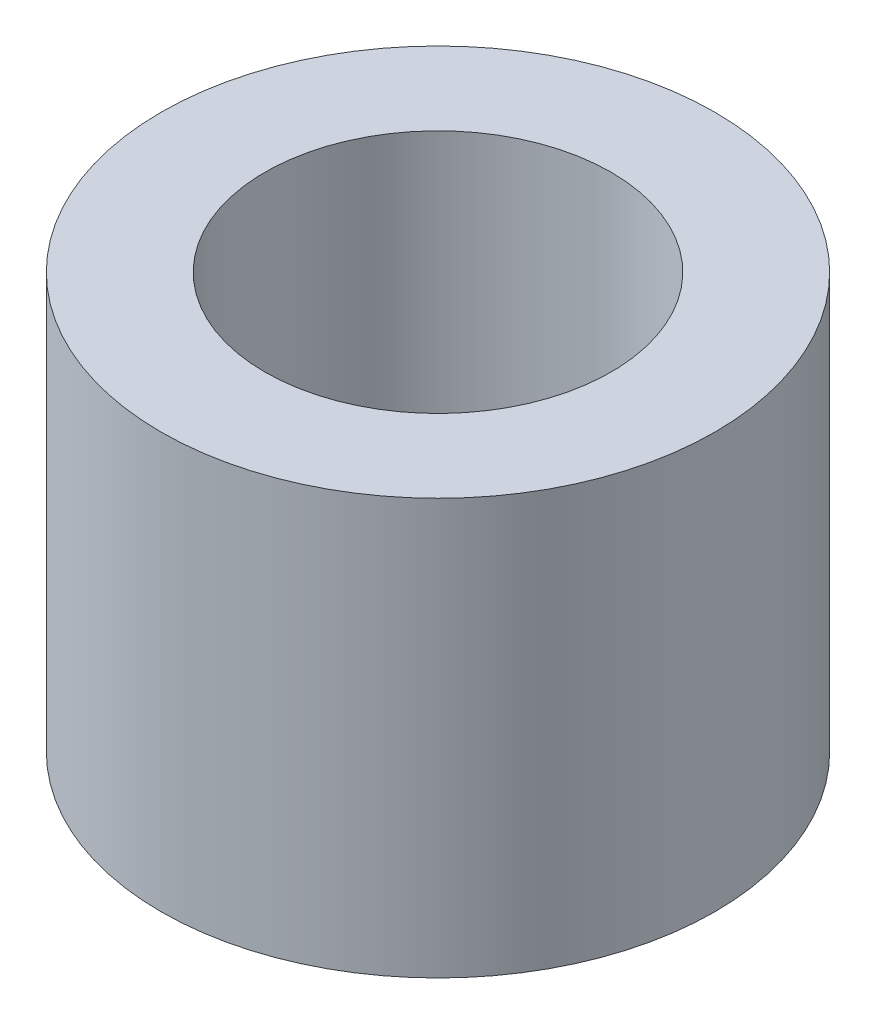
from build123d import *

# Parameters (mm, degrees)
SKETCH_1_R      = 4
SKETCH_1_R_2    = 2.5
EXTRUDE_1_DEPTH = 3


with BuildPart() as part:
    # 草图1 → 凸台-拉伸1 (new, symmetric)
    with BuildSketch(Plane(origin=(0, 0, 0), x_dir=(1, 0, 0), z_dir=(0, 1, 0))):
        with Locations(Location((0, 0, 0), (0, 0, 270))):
            Circle(SKETCH_1_R)
        with Locations(Location((0, 0, 0), (0, 0, 270))):
            Circle(SKETCH_1_R_2, mode=Mode.SUBTRACT)
    extrude(amount=EXTRUDE_1_DEPTH, both=True)


solid = part.part
